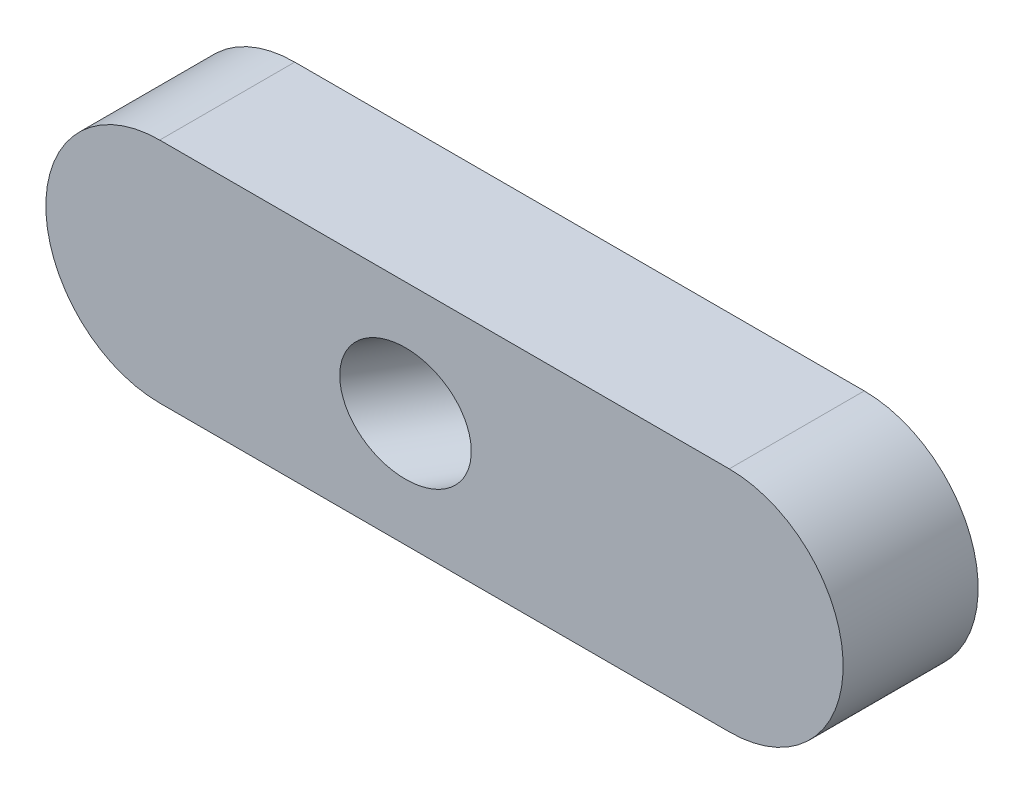
from build123d import *

# Parameters (mm, degrees)
BOSS_EXTRUDE1_DEPTH     = 3.556
CUT_EXTRUDE1_DEPTH      = 23.127926609
CUT_EXTRUDE1_DEPTH_BACK = 23.127926609
SKETCH6_R               = 3


with BuildPart() as part:
    # Sketch1 → Boss-Extrude1 (new, symmetric)
    with BuildSketch(Plane.XY):
        with BuildLine():
            Line((-15, 6), (15, 6))
            ThreePointArc((15, 6), (21, 0), (15, -6))
            Line((15, -6), (-15, -6))
            ThreePointArc((-15, -6), (-21, 0), (-15, 6))
        make_face()
    extrude(amount=BOSS_EXTRUDE1_DEPTH, both=True)

    # Sketch6 → Cut-Extrude1 (cut, two sides: drawn at the far end of the back side and taken through both)
    with BuildSketch(Plane(origin=(0, 0, 0), x_dir=(0, 1, 0), z_dir=(-0.500000000000001, 0, 0.866025403784438)).offset(-CUT_EXTRUDE1_DEPTH_BACK)):
        Circle(SKETCH6_R)
    extrude(amount=CUT_EXTRUDE1_DEPTH + CUT_EXTRUDE1_DEPTH_BACK, mode=Mode.SUBTRACT)


solid = part.part
